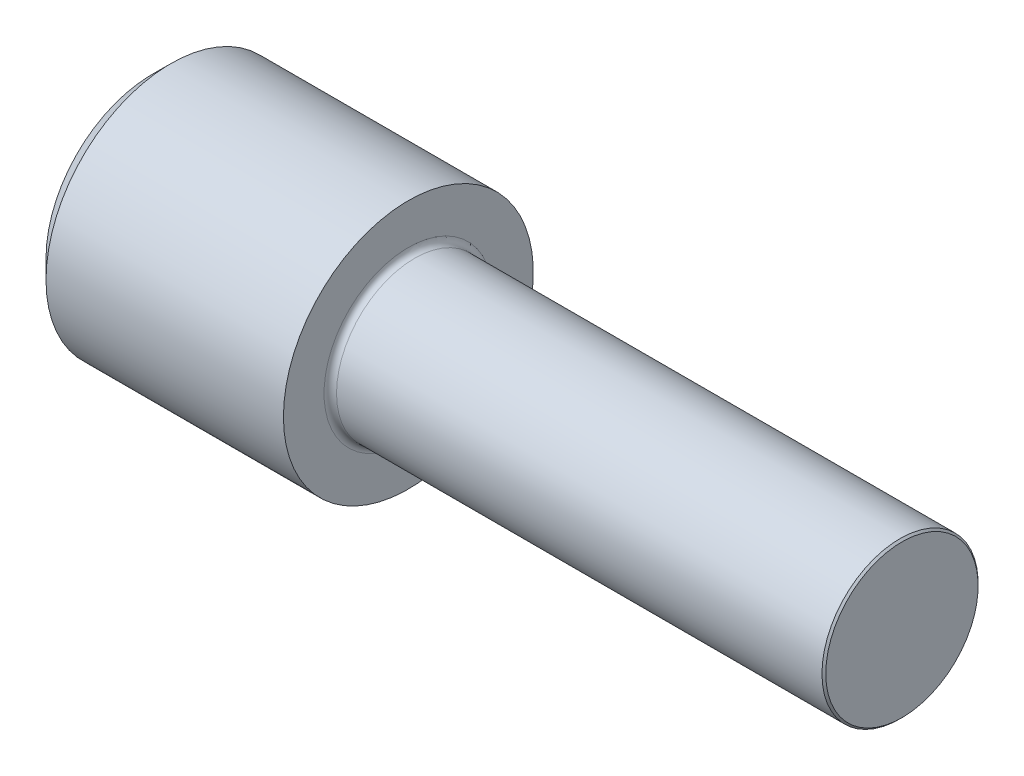
from build123d import *

# Parameters (mm, degrees)
FILLET1_R   = 0.1
HEX_2_DEPTH = 1.3


with BuildPart() as part:
    # BodySke → Base-Revolve (revolve)
    with BuildSketch(Plane.XY, mode=Mode.PRIVATE) as base_revolve_sk:
        Polygon((0, 0), (0, 1.7), (0.3, 2), (4.1, 2), (4.1, 1.25), (11.9695, 1.25), (12, 1.2195), (12, 0), align=None)
    revolve(base_revolve_sk.sketch.rotate(Axis((-31.75, 0, 0), (1, 0, 0)), 90), axis=Axis((-31.75, 0, 0), (1, 0, 0)))

    # Fillet1
    fillet1_edges = [part.edges().sort_by_distance(p)[0] for p in [
        (4.1, 0, -1.25),
    ]]
    fillet(fillet1_edges, radius=FILLET1_R)

    # Sketch2 → Hex-PreBroach (revolve, cut)
    with BuildSketch(Plane.XY, mode=Mode.PRIVATE) as hex_prebroach_sk:
        Polygon((0, 1.28), (1.3, 1.28), (2.039008345, 0), (0, 0), align=None)
    revolve(hex_prebroach_sk.sketch.rotate(Axis((0, 0, 0), (1, 0, 0)), 90), axis=Axis((0, 0, 0), (1, 0, 0)), mode=Mode.SUBTRACT)

    # Sketch3 → Hex 2 (cut)
    with BuildSketch(Plane(origin=(0, 0, 0), x_dir=(0, 0.500000000000001, 0.866025403784438), z_dir=(-1, 0, 0))):
        Polygon((0.739008345, 1.28), (-0.739008345, 1.28), (-1.478016689, 0), (-0.739008345, -1.28), (0.739008345, -1.28), (1.478016689, 0), align=None)
    extrude(amount=-HEX_2_DEPTH, mode=Mode.SUBTRACT)


solid = part.part
